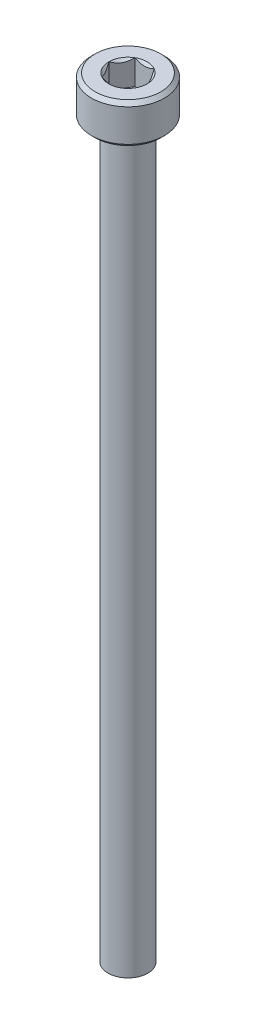
from build123d import *

# Parameters (mm, degrees)
SKETCH1_R           = 2.75
BOSS_EXTRUDE1_DEPTH = 3
CUT_EXTRUDE1_DEPTH  = 1.88
CHAMFER1_SIZE       = 0.275
SKETCH_1_R          = 1.5
EXTRUDE_1_DEPTH     = 55


with BuildPart() as part:
    # Sketch1 → Boss-Extrude1 (new body)
    with BuildSketch(Plane(origin=(0, 0, 0), x_dir=(1, 0, 0), z_dir=(0, 1, 0))):
        with Locations(Location((0, 0, 0), (0, 0, 270))):
            Circle(SKETCH1_R)
    extrude(amount=BOSS_EXTRUDE1_DEPTH)

    # Sketch2 → Cut-Extrude1 (cut)
    with BuildSketch(Plane(origin=(0, 3, 0), x_dir=(1, 0, 0), z_dir=(0, 1, 0))):
        Polygon((0.721687836, 1.25), (-0.721687836, 1.25), (-1.443375673, 0), (-0.721687836, -1.25), (0.721687836, -1.25), (1.443375673, 0), align=None)
    extrude(amount=-CUT_EXTRUDE1_DEPTH, mode=Mode.SUBTRACT)

    # Cut-Extrude2 cone 1 section (through the dimple's axis) → Cut-Extrude2 (revolve, cut)
    with BuildSketch(Plane(origin=(0, 3, 0), x_dir=(0, 0, 1), z_dir=(1, 0, 0))):
        Polygon((0, 0), (1.443375673, 0), (0, 1.443375673), align=None)
    revolve(axis=Axis((0, 3, 0), (0, -1, 0)), mode=Mode.SUBTRACT)

    # Chamfer1
    chamfer1_edges = [part.edges().sort_by_distance(p)[0] for p in [
        (0, 0, -2.75),
        (0, 3, -2.75),
    ]]
    chamfer(chamfer1_edges, length=CHAMFER1_SIZE)

    # 草图1 → 凸台-拉伸1 (add)
    with BuildSketch(Plane(origin=(0, 0, 0), x_dir=(-1, 0, 0), z_dir=(0, -1, 0))):
        with Locations(Location((0, 0, 0), (0, 0, 90))):
            Circle(SKETCH_1_R)
    extrude(amount=EXTRUDE_1_DEPTH)


solid = part.part
